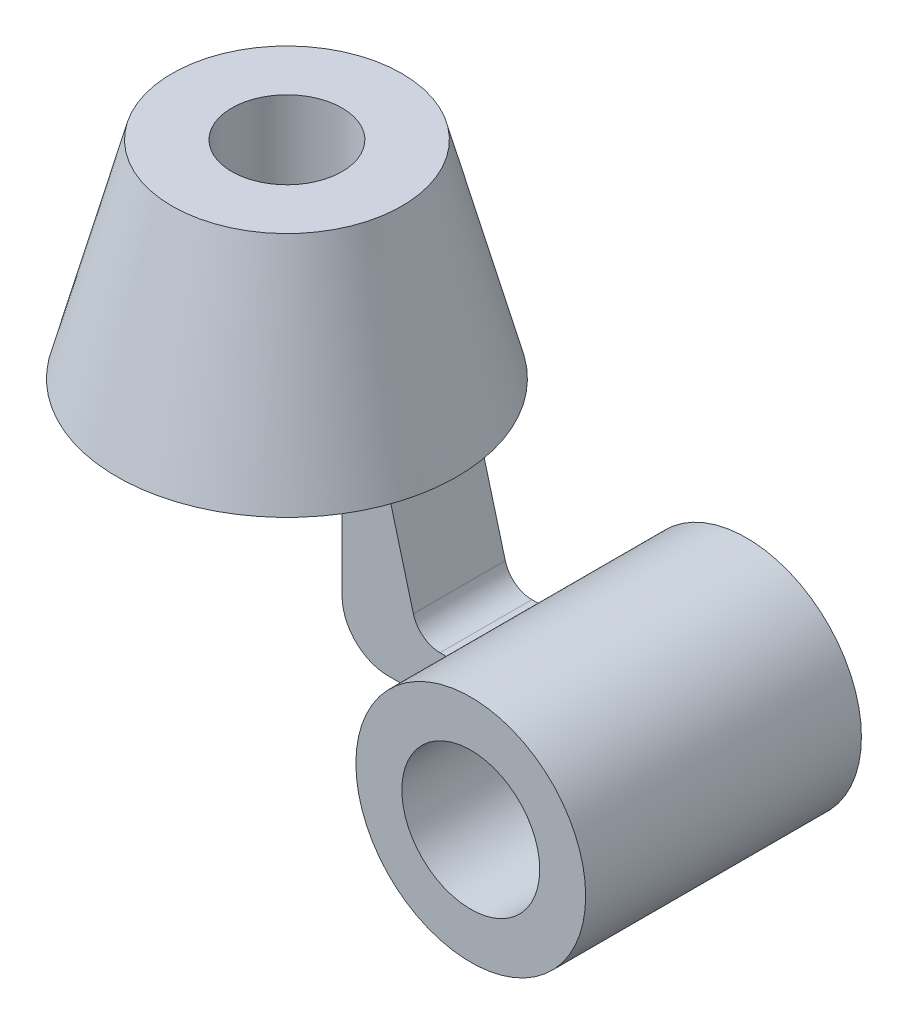
from build123d import *

# Parameters (mm, degrees)
SKETCH1_R           = 14.999999999999998
BOSS_EXTRUDE1_DEPTH = 30
BOSS_EXTRUDE2_DEPTH = 10


with BuildPart() as part:
    # Sketch1 → Boss-Extrude1 (new, symmetric)
    with BuildSketch(Plane.XY):
        with BuildLine():
            ThreePointArc((47.08712152522081, 10.000000000000007), (45.52734217673243, 5.107741092230509), (45.000000000000014, 4.9e-15))
            ThreePointArc((45.000000000000014, 4.9e-15), (70, -24.999999999999986), (94.99999999999999, -4.29e-15))
            ThreePointArc((94.99999999999999, 1.84e-15), (75.1077410922305, 24.472657823267575), (47.08712152522081, 10.000000000000007))
        make_face()
        with Locations((70, 1.84e-15)):
            Circle(SKETCH1_R, mode=Mode.SUBTRACT)
    extrude(amount=BOSS_EXTRUDE1_DEPTH, both=True)

    # Sketch1<3> → Boss-Extrude2 (add, symmetric)
    with BuildSketch(Plane.XY):
        with BuildLine():
            Line((32.00000000000007, -2.25e-15), (45.00000000000001, -6.7e-16))
            ThreePointArc((45.000000000000014, 4.9e-15), (45.52734217673243, 5.107741092230509), (47.08712152522081, 10.000000000000007))
            Line((47.08712152522081, 10), (43.30269173865172, 10))
            ThreePointArc((43.30269173865172, 10), (39.65012316459935, 11.239879958252601), (37.507136780917264, 14.447085729384943))
            Line((37.507136780917264, 14.447085729384945), (32, 35))
            Line((32, 35), (22, 35))
            Line((22, 35), (22, 10.000000000000068))
            ThreePointArc((22, 10.000000000000066), (24.928932188134524, 2.928932188134522), (32.00000000000007, -1.78e-15))
        make_face()
    extrude(amount=BOSS_EXTRUDE2_DEPTH, both=True)

    # Sketch2 → Revolve1 (revolve)
    with BuildSketch(Plane.XY):
        Polygon((12.000000000000002, 80), (12.000000000000007, 35), (37, 35), (25, 80), align=None)
    revolve(axis=Axis((0, 35, 0), (0, 1, 0)))


solid = part.part
